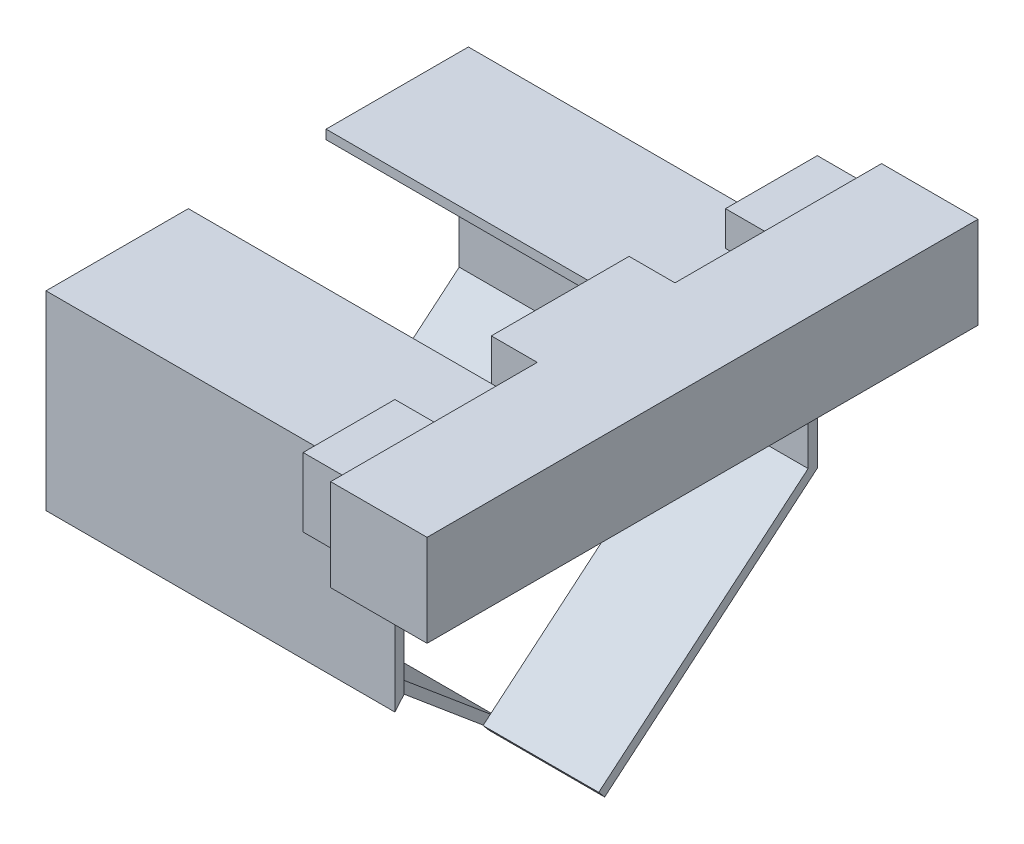
from build123d import *

# Parameters (mm, degrees)
EXTRUDE_THIN4_DEPTH   = 96.52
EXTRUDE_THIN4_2_DEPTH = 96.52
SKETCH5_W             = 32.004
SKETCH5_H             = 76.792210726
CUT_EXTRUDE2_DEPTH    = 26.67
SKETCH6_W             = 32.512
SKETCH6_H             = 76.792210726
CUT_EXTRUDE3_DEPTH    = 26.67
SKETCH7_W             = 152.4
SKETCH7_H             = 25.4
BOSS_EXTRUDE1_DEPTH   = 26.67
BOSS_EXTRUDE2_DEPTH   = 12.7
SKETCH13_W            = 25.4
SKETCH13_H            = 19.05
BOSS_EXTRUDE3_DEPTH   = 12.7


with BuildPart() as part:
    # Sketch1 → Extrude-Thin4 (new body)
    with BuildSketch(Plane(origin=(0, 0, 0), x_dir=(0, 0, -1), z_dir=(1, 0, 0))):
        Polygon((19.05, -1.27), (55.88, -1.27), (55.88, -50.207789274), (-2.03892683, -98.807539415), (-0.406246301, -100.753292301), (58.42, -51.392210726), (58.42, 1.27), (19.05, 1.27), align=None)
    extrude(amount=EXTRUDE_THIN4_DEPTH)

    # Sketch6 → Cut-Extrude3 (cut)
    with BuildSketch(Plane(origin=(0, -58.924421698, -49.443460514), x_dir=(1, 0, 0), z_dir=(0, -0.7660444431189791, -0.6427876096865379))):
        with Locations((48.26, 26.678065285)):
            Rectangle(SKETCH6_W, SKETCH6_H)
    extrude(amount=-CUT_EXTRUDE3_DEPTH, mode=Mode.SUBTRACT)



with BuildPart() as body_2:
    # Sketch1 → Extrude-Thin4 2 (new body)
    with BuildSketch(Plane(origin=(0, 0, 0), x_dir=(0, 0, -1), z_dir=(1, 0, 0))):
        Polygon((-19.05, 1.27), (-58.42, 1.27), (-58.42, -51.392210726), (0.406246301, -100.753292301), (2.03892683, -98.807539415), (-55.88, -50.207789274), (-55.88, -1.27), (-19.05, -1.27), align=None)
    extrude(amount=EXTRUDE_THIN4_2_DEPTH)

    # Sketch5 → Cut-Extrude2 (cut)
    with BuildSketch(Plane(origin=(0, -58.924421698, 49.443460514), x_dir=(1, 0, 0), z_dir=(0, -0.7660444431189799, 0.6427876096865373))):
        with Locations((16.002, -26.678065285)):
            Rectangle(SKETCH5_W, SKETCH5_H)
        with Locations((80.518, -26.678065285)):
            Rectangle(SKETCH5_W, SKETCH5_H)
    extrude(amount=-CUT_EXTRUDE2_DEPTH, mode=Mode.SUBTRACT)


with BuildPart() as part_1:
    add(part.part)

    add(body_2.part)  # Boss-Extrude1 merges body 2
    # Sketch7 → Boss-Extrude1 (add)
    with BuildSketch(Plane(origin=(96.52, 0, 0), x_dir=(0, 0, -1), z_dir=(1, 0, 0))):
        Rectangle(SKETCH7_W, SKETCH7_H)
    extrude(amount=BOSS_EXTRUDE1_DEPTH)

    # Sketch8 → Boss-Extrude2 (add)
    with BuildSketch(Plane.ZY.offset(-96.52)):
        Polygon((0, -12.7), (0, 12.7), (-19.05, 12.7), (-19.05, 1.27), (-19.05, -1.27), (-19.05, -12.7), align=None)
        Polygon((19.05, 1.27), (19.05, 12.7), (0, 12.7), (0, -12.7), (19.05, -12.7), (19.05, -1.27), align=None)
    extrude(amount=BOSS_EXTRUDE2_DEPTH)

    # Sketch13 → Boss-Extrude3 (add)
    with BuildSketch(Plane.ZY.offset(-96.52)):
        with Locations((-58.42, 1.27)):
            Rectangle(SKETCH13_W, SKETCH13_H)
        with Locations((58.42, 1.27)):
            Rectangle(SKETCH13_W, SKETCH13_H)
    extrude(amount=BOSS_EXTRUDE3_DEPTH)


solid = part_1.part
